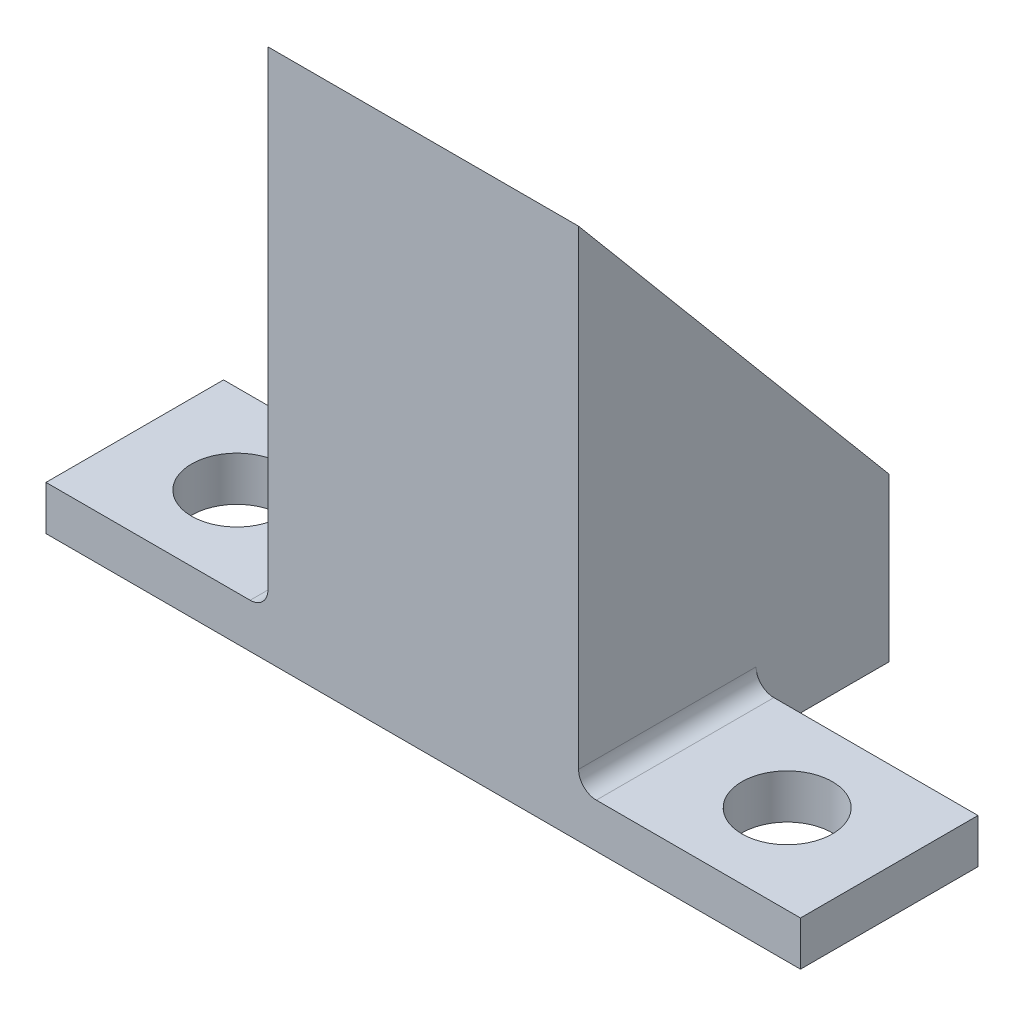
from build123d import *

# Parameters (mm, degrees)
SKETCH1_W           = 44.45
SKETCH1_H           = 88.9
BOSS_EXTRUDE1_DEPTH = 76.2
CUT_EXTRUDE1_DEPTH  = 76.2
SKETCH3_W           = 25.4
SKETCH3_H           = 6.35
BOSS_EXTRUDE2_DEPTH = 31.75
FILLET1_R           = 2.54
SKETCH4_R           = 6.477
CUT_EXTRUDE2_DEPTH  = 38.1
SKETCH5_W           = 25.4
SKETCH5_H           = 6.35
BOSS_EXTRUDE3_DEPTH = 31.75
FILLET2_R           = 2.54


with BuildPart() as part:
    # Sketch1 → Boss-Extrude1 (new body)
    with BuildSketch(Plane(origin=(0, 0, 0), x_dir=(1, 0, 0), z_dir=(0, 1, 0))):
        with Locations((22.225, 44.45)):
            Rectangle(SKETCH1_W, SKETCH1_H)
    extrude(amount=BOSS_EXTRUDE1_DEPTH)

    # Sketch2 → Cut-Extrude1 (cut)
    with BuildSketch(Plane(origin=(44.45, 0, 0), x_dir=(0, 0, -1), z_dir=(1, 0, 0))):
        Polygon((44.45, 23.226552809), (44.45, 0), (88.9, 0), (88.9, 76.2), (0, 76.2), align=None)
    extrude(amount=-CUT_EXTRUDE1_DEPTH, mode=Mode.SUBTRACT)

    # Sketch3 → Boss-Extrude2 (add)
    with BuildSketch(Plane(origin=(44.45, 0, 0), x_dir=(0, 0, -1), z_dir=(1, 0, 0))):
        with Locations((12.7, 3.175)):
            Rectangle(SKETCH3_W, SKETCH3_H)
    extrude(amount=BOSS_EXTRUDE2_DEPTH)

    # Fillet1
    fillet1_edges = [part.edges().sort_by_distance(p)[0] for p in [
        (44.45, 6.35, -12.7),
    ]]
    fillet(fillet1_edges, radius=FILLET1_R)

    # Sketch4 → Cut-Extrude2 (cut)
    with BuildSketch(Plane(origin=(0, 6.35, 0), x_dir=(1, 0, 0), z_dir=(0, 1, 0))):
        with Locations(Location((61.595, 12.7, 0), (0, 0, 270))):
            Circle(SKETCH4_R)
    cut_extrude2 = extrude(amount=-CUT_EXTRUDE2_DEPTH, mode=Mode.SUBTRACT)

    # Sketch5 → Boss-Extrude3 (add)
    with BuildSketch(Plane.ZY):
        with Locations((-12.7, 3.175)):
            Rectangle(SKETCH5_W, SKETCH5_H)
    extrude(amount=BOSS_EXTRUDE3_DEPTH)

    # Mirror4: Cut-Extrude2 across plane
    add(cut_extrude2.mirror(Plane(origin=(22.225, 0, 0), x_dir=(0, 0, 1), z_dir=(1, 0, 0))), mode=Mode.SUBTRACT)

    # Fillet2
    fillet2_edges = [part.edges().sort_by_distance(p)[0] for p in [
        (0, 6.35, -12.7),
    ]]
    fillet(fillet2_edges, radius=FILLET2_R)


solid = part.part
